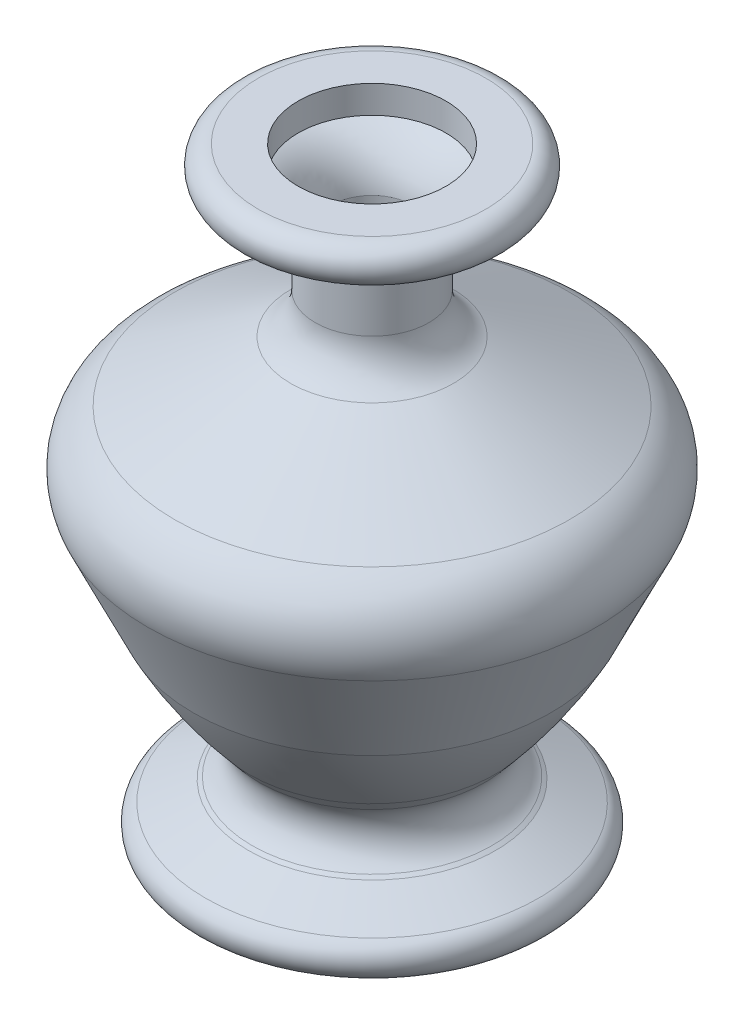
from build123d import *


with BuildPart() as part:
    # Sketch1 → Revolve4 (revolve)
    with BuildSketch(Plane.XY, mode=Mode.PRIVATE) as revolve4_sk:
        with BuildLine():
            Line((-66.428136906, 6.763199741), (-60.076567906, 6.763199741))
            Line((-60.076567906, 6.763199741), (-60.076567906, 11.163199741))
            Line((-60.076567906, 11.163199741), (-66.428136906, 11.163199741))
            Line((-66.428136906, 11.163199741), (-101.842394226, 11.163199741))
            ThreePointArc((-101.842394226, 11.163199741), (-102.427913092, 11.632174333), (-102.098120388, 12.305974216))
            Line((-102.098120388, 12.305974216), (-90.576125942, 17.734518757))
            Line((-90.576125942, 17.734518757), (-89.355814977, 18.523329602))
            ThreePointArc((-89.355814977, 18.523329602), (-83.37369714, 27.82092558), (-86.415593116, 38.450031547))
            Line((-86.415593116, 38.450031547), (-89.224287042, 41.757920064))
            ThreePointArc((-89.224287042, 41.757920064), (-96.761571163, 51.623852225), (-103.242762541, 62.213537189))
            Line((-103.242762541, 62.213537189), (-115.254254583, 87.707726936))
            ThreePointArc((-115.254254583, 87.707726936), (-115.749508892, 96.367167151), (-110.100979816, 102.949362905))
            Line((-110.100979816, 102.949362905), (-79.52639659, 118.805434852))
            ThreePointArc((-79.52639659, 118.805434852), (-73.062596135, 124.845385977), (-70.676567906, 133.364106258))
            Line((-70.676567906, 133.364106258), (-70.676567906, 147.456440267))
            ThreePointArc((-70.676567906, 147.456440267), (-73.679966298, 154.530858616), (-79.576567906, 159.460147242))
            Line((-79.576567906, 159.460147242), (-79.576567906, 166.763199741))
            Line((-79.576567906, 166.763199741), (-90.076567906, 166.763199741))
            ThreePointArc((-90.076567906, 166.763199741), (-95.076567906, 161.763199741), (-90.076567906, 156.763199741))
            Line((-90.076567906, 156.763199741), (-86.8539118, 156.763199741))
            ThreePointArc((-86.8539118, 156.763199741), (-79.22537584, 154.026322276), (-75.076567906, 147.064106258))
            Line((-75.076567906, 147.064106258), (-75.076567906, 133.364106258))
            ThreePointArc((-75.076567906, 133.364106258), (-76.82244222, 127.130896297), (-81.552052309, 122.711419863))
            Line((-81.552052309, 122.711419863), (-112.126635535, 106.855347916))
            ThreePointArc((-112.126635535, 106.855347916), (-119.917710122, 97.776457221), (-119.23460073, 85.832401752))
            Line((-119.23460073, 85.832401752), (-107.169815801, 60.225098746))
            ThreePointArc((-107.169815801, 60.225098746), (-100.427028361, 49.189035556), (-92.578326293, 38.910040028))
            Line((-92.578326293, 38.910040028), (-89.769632367, 35.60215151))
            ThreePointArc((-89.769632367, 35.60215151), (-87.726567906, 28.463199741), (-91.744408244, 22.218545727))
            Line((-91.744408244, 22.218545727), (-92.71761855, 21.589461119))
            Line((-92.71761855, 21.589461119), (-103.973445572, 16.286320364))
            ThreePointArc((-103.973445572, 16.286320364), (-106.721718109, 10.67132134), (-101.842394226, 6.763199741))
            Line((-101.842394226, 6.763199741), (-66.428136906, 6.763199741))
        make_face()
    revolve(revolve4_sk.sketch.rotate(Axis((-60.076567906, 168.729058273, 0), (0, -1, 0)), 270), axis=Axis((-60.076567906, 168.729058273, 0), (0, -1, 0)))


solid = part.part
